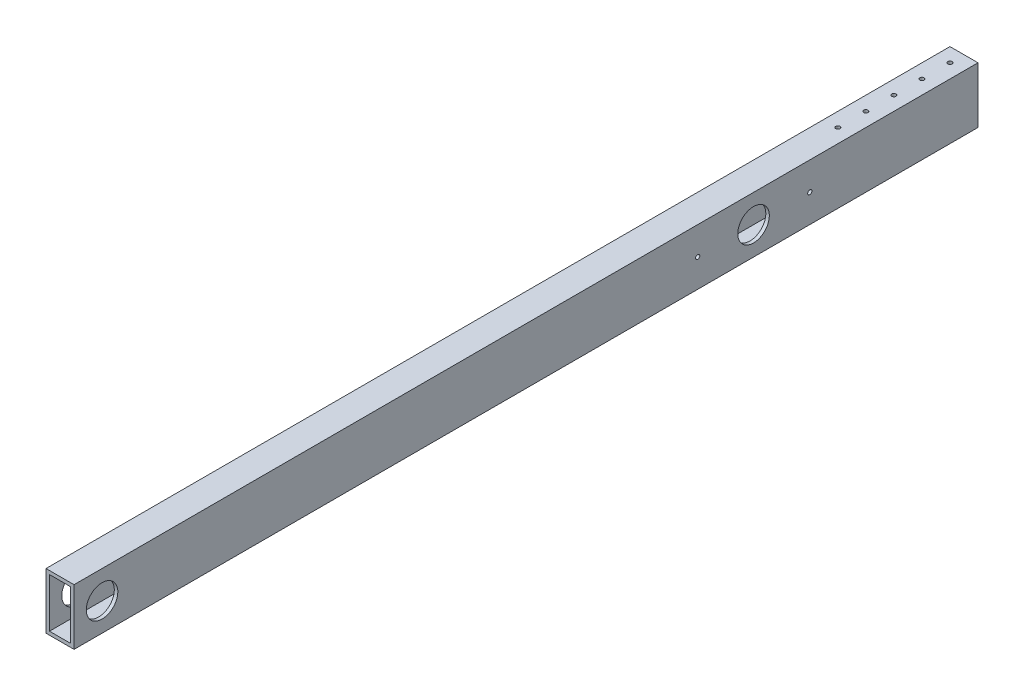
from build123d import *

# Parameters (mm, degrees)
SKETCH1_W           = 25.4
SKETCH1_H           = 50.8
SKETCH1_W_2         = 19.05
SKETCH1_H_2         = 44.45
BOSS_EXTRUDE1_DEPTH = 409.575
SKETCH7_R           = 1.905
CUT_EXTRUDE1_DEPTH  = 413.908719483
SKETCH8_R           = 1.905
SKETCH8_R_2         = 14.2875
CUT_EXTRUDE2_DEPTH  = 412.147176355


with BuildPart() as part:
    # Sketch1 → Boss-Extrude1 (new, symmetric)
    with BuildSketch(Plane.XY):
        Rectangle(SKETCH1_W, SKETCH1_H)
        Rectangle(SKETCH1_W_2, SKETCH1_H_2, mode=Mode.SUBTRACT)
    extrude(amount=BOSS_EXTRUDE1_DEPTH, both=True)

    # Sketch7 → Cut-Extrude1 (cut, through all)
    with BuildSketch(Plane(origin=(0, 25.4, 0), x_dir=(1, 0, 0), z_dir=(0, 1, 0))):
        with Locations(Location((0, 396.875, 0), (0, 0, 270))):
            Circle(SKETCH7_R)
        with Locations(Location((0, 371.475, 0), (0, 0, 270))):
            Circle(SKETCH7_R)
        with Locations(Location((0, 346.075, 0), (0, 0, 270))):
            Circle(SKETCH7_R)
        with Locations(Location((0, 320.675, 0), (0, 0, 270))):
            Circle(SKETCH7_R)
        with Locations(Location((0, 295.275, 0), (0, 0, 270))):
            Circle(SKETCH7_R)
    extrude(amount=-CUT_EXTRUDE1_DEPTH, mode=Mode.SUBTRACT)

    # Sketch8 → Cut-Extrude2 (cut, through all)
    with BuildSketch(Plane(origin=(12.7, 0, 0), x_dir=(0, 0, -1), z_dir=(1, 0, 0))):
        with Locations(Location((155.575, 0, 0), (0, 0, 90))):
            Circle(SKETCH8_R)
        with Locations(Location((257.175, 0, 0), (0, 0, 90))):
            Circle(SKETCH8_R)
        with Locations(Location((206.184267809, 0, 0), (0, 0, 90))):
            Circle(SKETCH8_R_2)
        with Locations(Location((-384.175, 0, 0), (0, 0, 90))):
            Circle(SKETCH8_R_2)
    extrude(amount=-CUT_EXTRUDE2_DEPTH, mode=Mode.SUBTRACT)


solid = part.part
